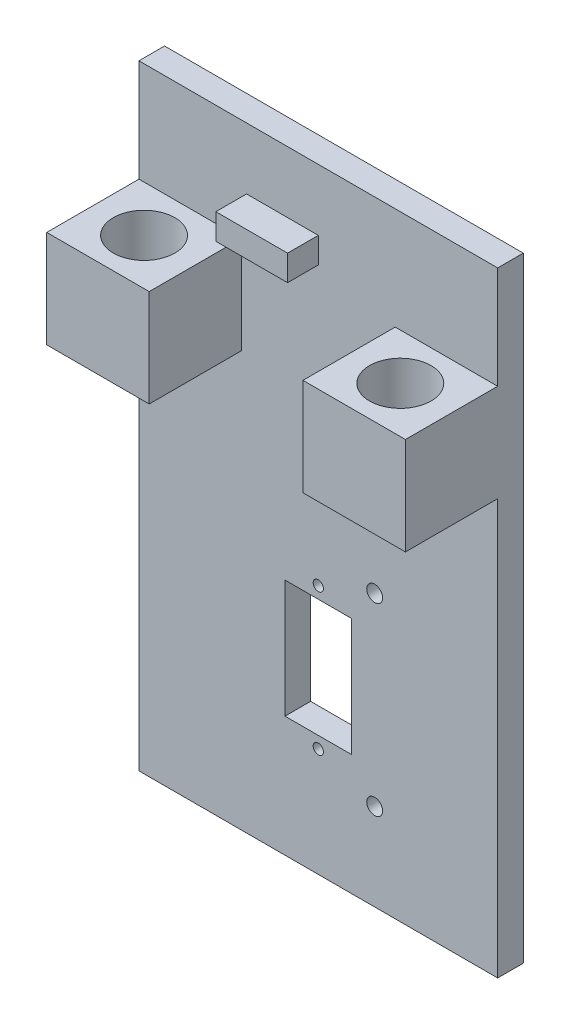
from build123d import *

# Parameters (mm, degrees)
SKETCH1_W           = 70
SKETCH1_H           = 120
BOSS_EXTRUDE1_DEPTH = 5
SKETCH2_W           = 20
SKETCH2_H           = 19
BOSS_EXTRUDE2_DEPTH = 18
SKETCH3_R           = 6
CUT_EXTRUDE1_DEPTH  = 109.415865998
CUT_EXTRUDE2_REACH  = 75.171
SKETCH4_R           = 1
SKETCH4_W           = 13
SKETCH4_H           = 23
SKETCH5_W           = 14
SKETCH5_H           = 5
BOSS_EXTRUDE3_DEPTH = 6
SKETCH6_R           = 1.55
CUT_EXTRUDE3_DEPTH  = 74.17103252


with BuildPart() as part:
    # Sketch1 → Boss-Extrude1 (new body)
    with BuildSketch(Plane.XY):
        Rectangle(SKETCH1_W, SKETCH1_H)
    extrude(amount=BOSS_EXTRUDE1_DEPTH)

    # Sketch2 → Boss-Extrude2 (add)
    with BuildSketch(Plane.XY.offset(5)):
        with Locations((-25, 30.5)):
            Rectangle(SKETCH2_W, SKETCH2_H)
        with Locations((25, 30.5)):
            Rectangle(SKETCH2_W, SKETCH2_H)
    extrude(amount=BOSS_EXTRUDE2_DEPTH)

    # Sketch3 → Cut-Extrude1 (cut, through all)
    with BuildSketch(Plane(origin=(0, 40, 0), x_dir=(1, 0, 0), z_dir=(0, 1, 0))):
        with Locations(Location((-25, -14, 0), (0, 0, 180))):
            Circle(SKETCH3_R)
        with Locations(Location((25, -14, 0), (0, 0, 180))):
            Circle(SKETCH3_R)
    extrude(amount=-CUT_EXTRUDE1_DEPTH, mode=Mode.SUBTRACT)

    # Sketch4 → Cut-Extrude2 (cut, up to next)
    with BuildSketch(Plane(origin=(0, 0, 0), x_dir=(-1, 0, 0), z_dir=(0, 0, -1)), mode=Mode.PRIVATE) as cut_extrude2_sk1:
        with Locations((0, -11.2)):
            Circle(SKETCH4_R)
    cut_extrude2_tool1 = extrude(cut_extrude2_sk1.sketch, amount=-CUT_EXTRUDE2_REACH, mode=Mode.PRIVATE) & part.part
    # Sketch4 → Cut-Extrude2 (cut, up to next)
    with BuildSketch(Plane(origin=(0, 0, 0), x_dir=(-1, 0, 0), z_dir=(0, 0, -1)), mode=Mode.PRIVATE) as cut_extrude2_sk2:
        with Locations((0, -38.8)):
            Circle(SKETCH4_R)
    cut_extrude2_tool2 = extrude(cut_extrude2_sk2.sketch, amount=-CUT_EXTRUDE2_REACH, mode=Mode.PRIVATE) & part.part
    # Sketch4 → Cut-Extrude2 (cut, up to next)
    with BuildSketch(Plane(origin=(0, 0, 0), x_dir=(-1, 0, 0), z_dir=(0, 0, -1)), mode=Mode.PRIVATE) as cut_extrude2_sk3:
        with Locations((0, -25)):
            Rectangle(SKETCH4_W, SKETCH4_H)
    cut_extrude2_tool3 = extrude(cut_extrude2_sk3.sketch, amount=-CUT_EXTRUDE2_REACH, mode=Mode.PRIVATE) & part.part
    add(cut_extrude2_tool1.solids().sort_by_distance((0, -11.2, 0))[0], mode=Mode.SUBTRACT)
    add(cut_extrude2_tool2.solids().sort_by_distance((0, -38.8, 0))[0], mode=Mode.SUBTRACT)
    add(cut_extrude2_tool3.solids().sort_by_distance((0, -25, 0))[0], mode=Mode.SUBTRACT)

    # Sketch5 → Boss-Extrude3 (add)
    with BuildSketch(Plane.XY.offset(5)):
        with Locations((-7, 45.5)):
            Rectangle(SKETCH5_W, SKETCH5_H)
    extrude(amount=BOSS_EXTRUDE3_DEPTH)

    # Sketch6 → Cut-Extrude3 (cut, through all)
    with BuildSketch(Plane(origin=(0, 0, 0), x_dir=(-1, 0, 0), z_dir=(0, 0, -1))):
        with Locations((-11, -7)):
            Circle(SKETCH6_R)
        with Locations((-11, -43)):
            Circle(SKETCH6_R)
    extrude(amount=-CUT_EXTRUDE3_DEPTH, mode=Mode.SUBTRACT)


solid = part.part
